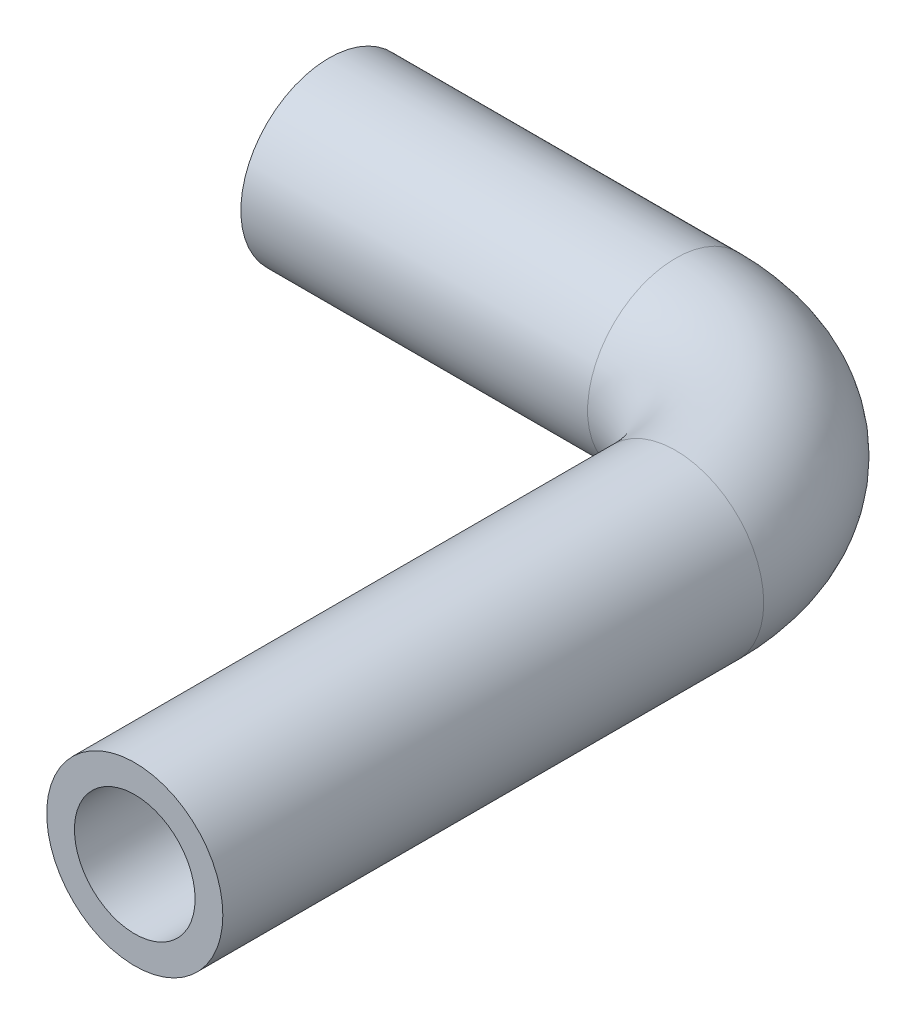
from build123d import *

# Parameters (mm, degrees)
TUBE_PROFILE_R   = 3.175
TUBE_PROFILE_R_2 = 2.175


with BuildPart() as part:
    # Tube: sweep along a curve in space
    with BuildLine() as tube_path:
        Line((182, 326, 175.5), (182, 326, 156))
        ThreePointArc((176, 326, 150), (180.242640687, 326, 151.757359313), (182, 326, 156))
        Line((176, 326, 150), (163.5, 326, 150))
    # Tube profile (on start of the path) → Tube (sweep)
    with BuildSketch(Plane(origin=(182, 326, 175.5), x_dir=(-1, 0, 0), z_dir=(0, 0, -1))):
        Circle(TUBE_PROFILE_R)
        Circle(TUBE_PROFILE_R_2, mode=Mode.SUBTRACT)
    sweep(path=tube_path.line)


solid = part.part
